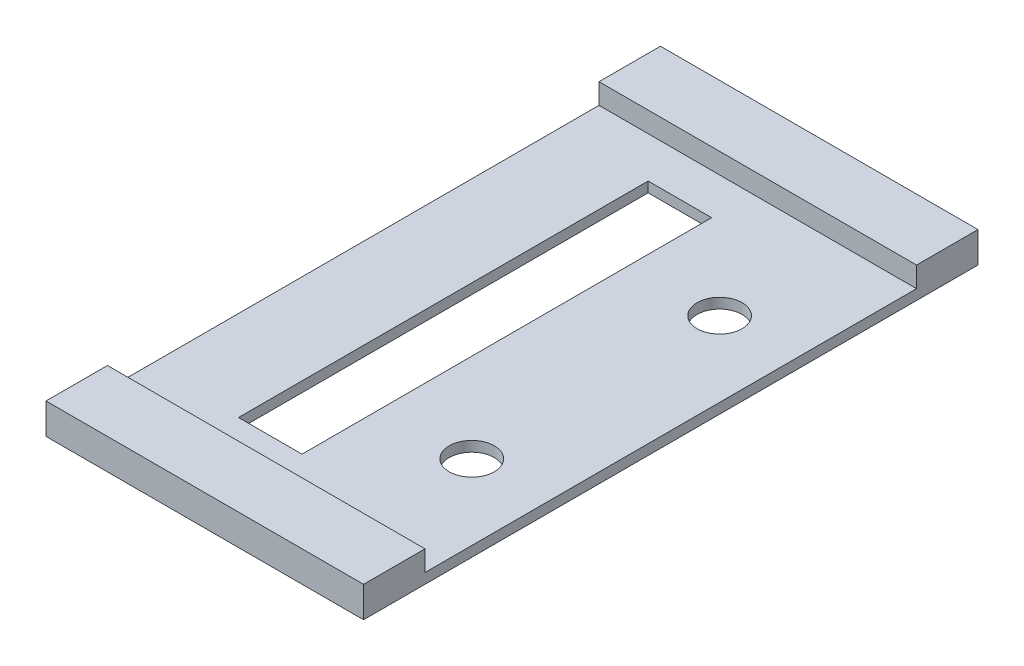
from build123d import *

# Parameters (mm, degrees)
SKETCH2_W             = 39.3827
SKETCH2_H             = 7.62
BOSS_EXTRUDE2_DEPTH   = 3.81
BOSS_EXTRUDE2_2_DEPTH = 3.81
SKETCH2_3_W           = 39.3827
SKETCH2_3_H           = 60.96
SKETCH2_3_R           = 2.794
BOSS_EXTRUDE3_DEPTH   = 1.27


with BuildPart() as part:
    # Sketch2 → Boss-Extrude2 (new body)
    with BuildSketch(Plane(origin=(0, 0, 0), x_dir=(1, 0, 0), z_dir=(0, 1, 0))):
        with Locations((19.69135, 3.81)):
            Rectangle(SKETCH2_W, SKETCH2_H)
    extrude(amount=BOSS_EXTRUDE2_DEPTH)



with BuildPart() as body_2:
    # Sketch2 → Boss-Extrude2 2 (new body)
    with BuildSketch(Plane(origin=(0, 0, 0), x_dir=(1, 0, 0), z_dir=(0, 1, 0))):
        with Locations((19.69135, 72.39)):
            Rectangle(SKETCH2_W, SKETCH2_H)
    extrude(amount=BOSS_EXTRUDE2_2_DEPTH)


with BuildPart() as part_1:
    add(part.part)

    add(body_2.part)  # Boss-Extrude3 merges body 2
    # Sketch2<3> → Boss-Extrude3 (add)
    with BuildSketch(Plane(origin=(0, 0, 0), x_dir=(1, 0, 0), z_dir=(0, 1, 0))):
        with Locations((19.69135, 38.1)):
            Rectangle(SKETCH2_3_W, SKETCH2_3_H)
        Polygon((19.05, 63.5), (19.05, 38.1), (19.05, 12.7), (11.176, 12.7), (11.176, 63.5), align=None, mode=Mode.SUBTRACT)
        with Locations((30.067932262, 22.733)):
            Circle(SKETCH2_3_R, mode=Mode.SUBTRACT)
        with Locations((30.067932262, 53.467)):
            Circle(SKETCH2_3_R, mode=Mode.SUBTRACT)
    extrude(amount=BOSS_EXTRUDE3_DEPTH)


solid = part_1.part
